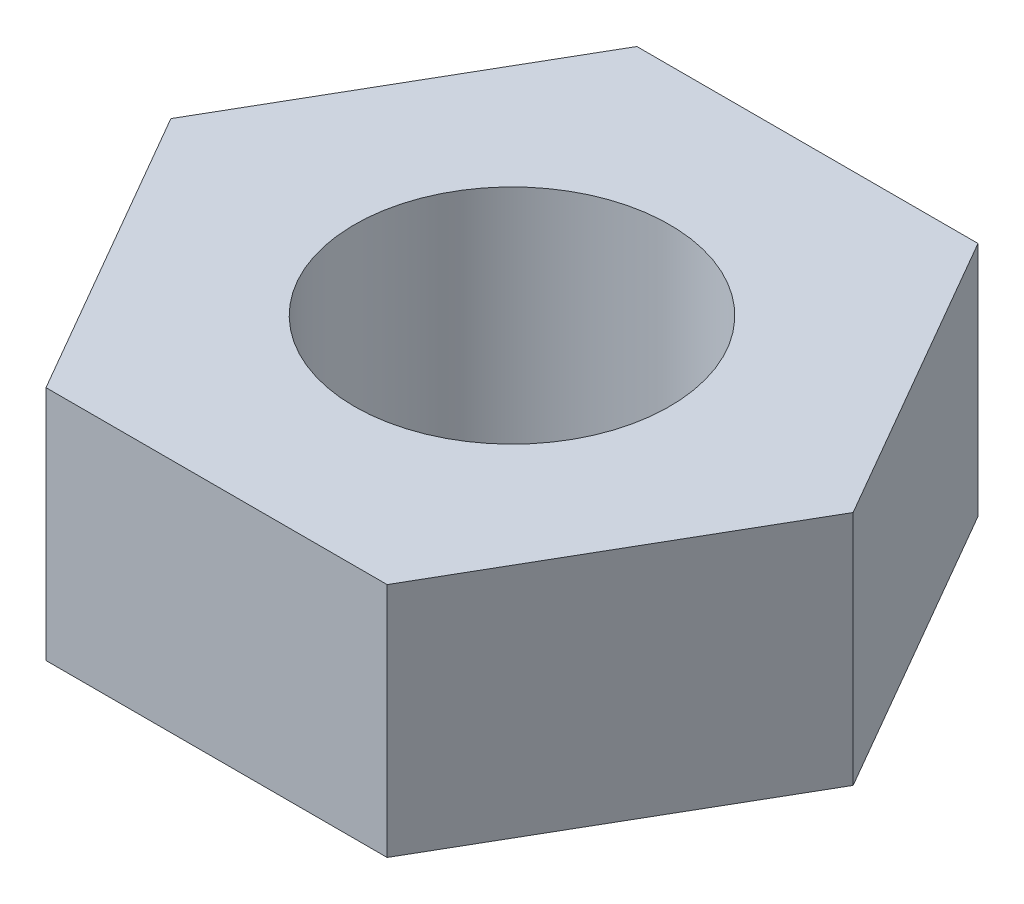
from build123d import *

# Parameters (mm, degrees)
SKETCH1_R           = 2
BOSS_EXTRUDE1_DEPTH = 3


with BuildPart() as part:
    # Sketch1 → Boss-Extrude1 (new body)
    with BuildSketch(Plane(origin=(0, 0, 0), x_dir=(1, 0, 0), z_dir=(0, 1, 0))):
        Polygon((4.330127019, 0), (2.165063509, 3.75), (-2.165063509, 3.75), (-4.330127019, 0), (-2.165063509, -3.75), (2.165063509, -3.75), align=None)
        with Locations(Location((0, 0, 0), (0, 0, 270))):
            Circle(SKETCH1_R, mode=Mode.SUBTRACT)
    extrude(amount=BOSS_EXTRUDE1_DEPTH)


solid = part.part
